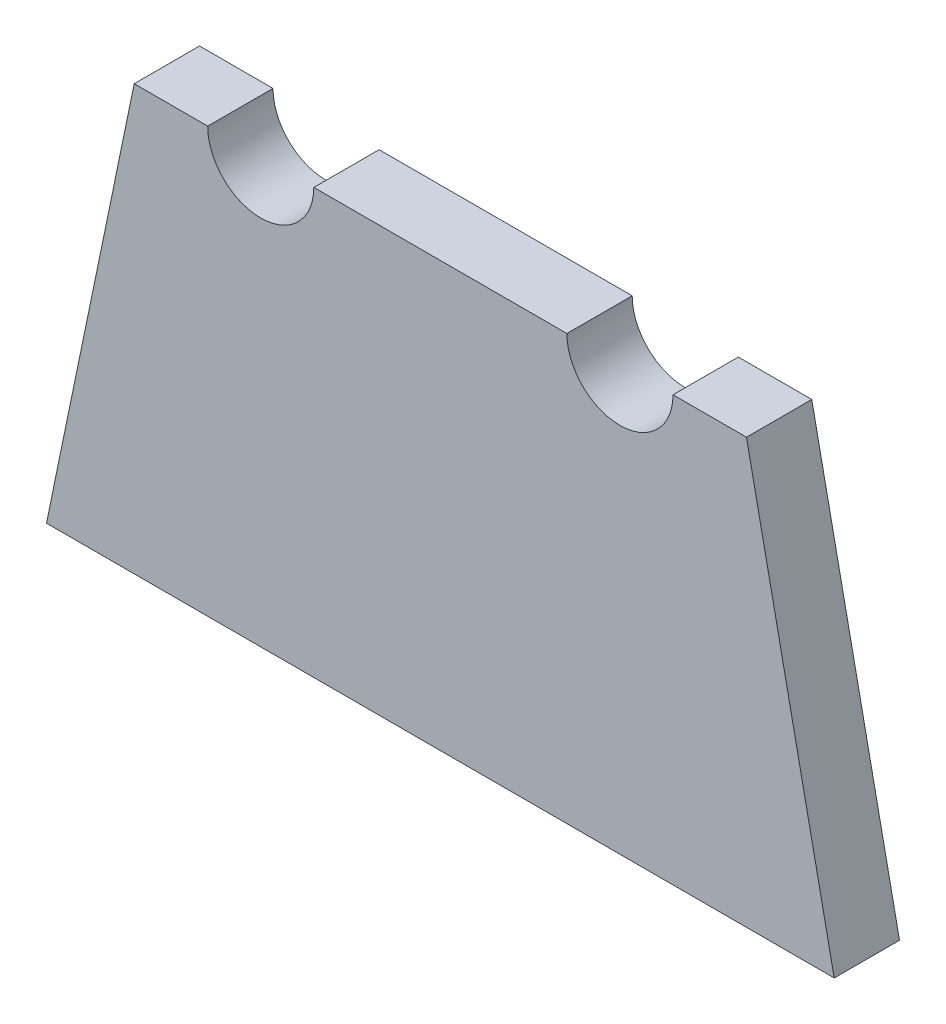
from build123d import *

# Parameters (mm, degrees)
BOSS_EXTRUDE1_DEPTH = 0.8


with BuildPart() as part:
    # Sketch1 → Boss-Extrude1 (new body)
    with BuildSketch(Plane.XY):
        with BuildLine():
            Line((4.825, -2.895431569), (3.75, 2.304568431))
            Line((3.75, 2.304568431), (2.85, 2.304568431))
            ThreePointArc((2.85, 2.304568431), (2.2, 1.654568431), (1.55, 2.304568431))
            Line((1.55, 2.304568431), (-1.55, 2.304568431))
            ThreePointArc((-1.55, 2.304568431), (-2.2, 1.654568431), (-2.85, 2.304568431))
            Line((-2.85, 2.304568431), (-3.75, 2.304568431))
            Line((-3.75, 2.304568431), (-4.825, -2.895431569))
            Line((-4.825, -2.895431569), (4.825, -2.895431569))
        make_face()
    extrude(amount=BOSS_EXTRUDE1_DEPTH)


solid = part.part
